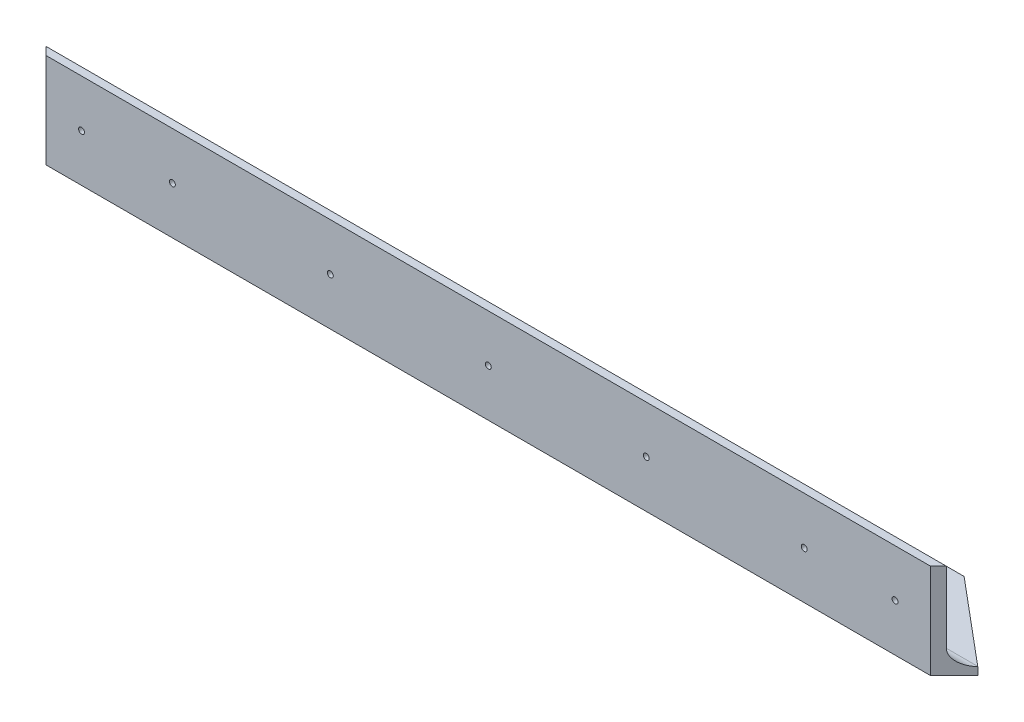
from build123d import *

# Parameters (mm, degrees)
BOSS_EXTRUDE1_DEPTH              = 838.2
FILLET1_R                        = 12.7
F_17_64_0_26563_DIAMETER_HOLE1_D = 6.747002
LPATTERN1_COUNT                  = 6
LPATTERN1_PITCH                  = 127
CUT_EXTRUDE3_DEPTH               = 846.098881788
CUT_EXTRUDE4_DEPTH               = 846.098881788
CUT_EXTRUDE5_DEPTH               = 845.55
CUT_EXTRUDE6_DEPTH               = 845.55
F_3_16_0_1875_DIAMETER_HOLE1_D   = 4.7625
LPATTERN2_COUNT                  = 3
LPATTERN2_PITCH                  = 127
LPATTERN3_COUNT                  = 3
LPATTERN3_PITCH                  = 127
F_3_16_0_1875_DIAMETER_HOLE3_D   = 4.7625


with BuildPart() as part:
    # Sketch1 → Boss-Extrude1 (new body)
    with BuildSketch(Plane(origin=(0, 0, 0), x_dir=(0, 0, -1), z_dir=(1, 0, 0))):
        Polygon((0, 0), (76.2, 0), (76.2, 6.35), (6.35, 6.35), (6.35, 76.2), (0, 76.2), align=None)
    extrude(amount=BOSS_EXTRUDE1_DEPTH)

    # Fillet1
    fillet1_edges = [part.edges().sort_by_distance(p)[0] for p in [
        (419.1, 6.35, -6.35),
    ]]
    fillet(fillet1_edges, radius=FILLET1_R)

    # 17/64 (0.26563) Diameter Hole1 (through all)
    with Locations(Plane(origin=(0, 6.35, 0), x_dir=(1, 0, 0), z_dir=(0, 1, 0))):
        with Locations((101.6, 44.45)):
            f_17_64_0_26563_diameter_hole1 = Hole(F_17_64_0_26563_DIAMETER_HOLE1_D / 2)

    # LPattern1: 17/64 (0.26563) Diameter Hole1 ×6
    with Locations(*[(i * LPATTERN1_PITCH, 0, 0) for i in range(1, LPATTERN1_COUNT)]):
        add(f_17_64_0_26563_diameter_hole1, mode=Mode.SUBTRACT)

    # Sketch7 → Cut-Extrude3 (cut, through all)
    with BuildSketch(Plane.XZ):
        Polygon((63.5, 0), (-28.052450059, 0), (-28.052450059, -91.552450059), align=None)
    extrude(amount=-CUT_EXTRUDE3_DEPTH, mode=Mode.SUBTRACT)

    # Sketch8 → Cut-Extrude4 (cut, through all)
    with BuildSketch(Plane.XZ):
        Polygon((774.7, 0), (864.325160155, 0), (864.325160155, -89.625160155), align=None)
    extrude(amount=-CUT_EXTRUDE4_DEPTH, mode=Mode.SUBTRACT)

    # Sketch12 → Cut-Extrude5 (cut, through all)
    with BuildSketch(Plane(origin=(0, 6.35, 0), x_dir=(1, 0, 0), z_dir=(0, 1, 0))):
        Polygon((44.549132772, 18.950867228), (112.775992426, 76.2), (-12.7, 76.2), align=None)
    extrude(amount=-CUT_EXTRUDE5_DEPTH, mode=Mode.SUBTRACT)

    # Sketch14 → Cut-Extrude6 (cut, through all)
    with BuildSketch(Plane(origin=(0, 6.35, 0), x_dir=(1, 0, 0), z_dir=(0, 1, 0))):
        Polygon((793.650867228, 18.950867228), (850.9, 76.2), (725.424007574, 76.2), align=None)
    extrude(amount=-CUT_EXTRUDE6_DEPTH, mode=Mode.SUBTRACT)

    # 3/16 (0.1875) Diameter Hole1 (through all)
    with Locations(Plane(origin=(0, 0, -6.35), x_dir=(-1, 0, 0), z_dir=(0, 0, -1))):
        with Locations((-419.1, 38.1)):
            f_3_16_0_1875_diameter_hole1 = Hole(F_3_16_0_1875_DIAMETER_HOLE1_D / 2)

    # LPattern2: 3/16 (0.1875) Diameter Hole1 ×3
    with Locations(*[(-i * LPATTERN2_PITCH, 0, 0) for i in range(1, LPATTERN2_COUNT)]):
        add(f_3_16_0_1875_diameter_hole1, mode=Mode.SUBTRACT)

    # LPattern3: 3/16 (0.1875) Diameter Hole1 ×3
    with Locations(*[(i * LPATTERN3_PITCH, 0, 0) for i in range(1, LPATTERN3_COUNT)]):
        add(f_3_16_0_1875_diameter_hole1, mode=Mode.SUBTRACT)

    # 3/16 (0.1875) Diameter Hole3 (through all)
    with Locations(Plane(origin=(0, 0, -6.35), x_dir=(-1, 0, 0), z_dir=(0, 0, -1))):
        with Locations((-746.125, 38.1), (-92.075, 38.1)):
            Hole(F_3_16_0_1875_DIAMETER_HOLE3_D / 2)


solid = part.part
